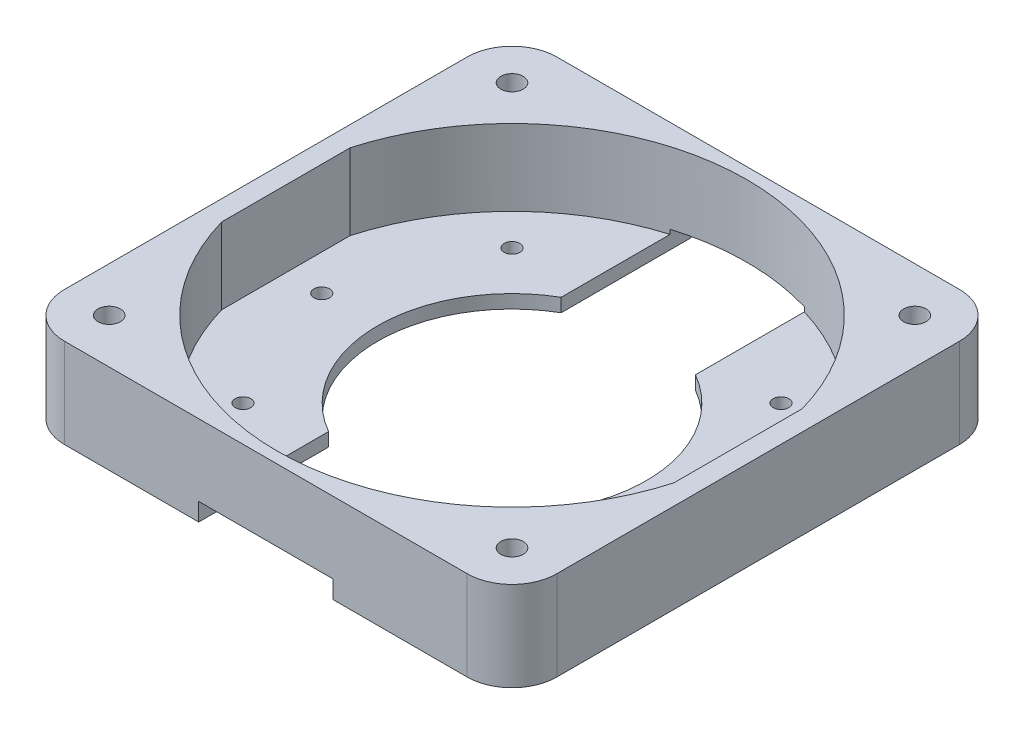
from build123d import *

# Parameters (mm, degrees)
SKETCH_1_W          = 110
SKETCH_1_H          = 110
EXTRUDE_5_DEPTH     = 20
CUT_EXTRUDE_2_DEPTH = 17
SKETCH_5_R          = 1.75
SKETCH_5_R_2        = 30
CUT_EXTRUDE_3_DEPTH = 17
SKETCH_7_W          = 30
SKETCH_7_H          = 114.29986349
CUT_EXTRUDE_4_DEPTH = 4
SKETCH_8_R          = 2.5
CUT_EXTRUDE_5_DEPTH = 81.311892021
FILLET_1_R          = 10
FILLET_2_R          = 10
FILLET_3_R          = 10
FILLET_4_R          = 10
CUT_EXTRUDE_6_DEPTH = 17
CUT_EXTRUDE_7_DEPTH = 17


with BuildPart() as part:
    # 草图1 → 凸台-拉伸5 (new body)
    with BuildSketch(Plane(origin=(0, 0, 0), x_dir=(1, 0, 0), z_dir=(0, 1, 0))):
        Rectangle(SKETCH_1_W, SKETCH_1_H)
    extrude(amount=EXTRUDE_5_DEPTH)

    # 草图4 → 切除-拉伸2 (cut)
    with BuildSketch(Plane(origin=(0, 20, 0), x_dir=(1, 0, 0), z_dir=(0, 1, 0))):
        with BuildLine():
            ThreePointArc((-47, -13.856406461), (0, -49), (47, -13.856406461))
            Line((47, -13.856406461), (47, 13.856406461))
            ThreePointArc((47, 13.856406461), (0, 49), (-47, 13.856406461))
            Line((-47, 13.856406461), (-47, -13.856406461))
        make_face()
    extrude(amount=-CUT_EXTRUDE_2_DEPTH, mode=Mode.SUBTRACT)

    # 草图5 → 切除-拉伸3 (cut)
    with BuildSketch(Plane(origin=(0, 3, 0), x_dir=(1, 0, 0), z_dir=(0, 1, 0))):
        with Locations(Location((0, 42.5, 0), (0, 0, 270))):
            Circle(SKETCH_5_R)
        with Locations(Location((30.0520382, 30.0520382, 0), (0, 0, 270))):
            Circle(SKETCH_5_R)
        with Locations(Location((42.5, 0, 0), (0, 0, 270))):
            Circle(SKETCH_5_R)
        with Locations(Location((30.0520382, -30.0520382, 0), (0, 0, 270))):
            Circle(SKETCH_5_R)
        with Locations(Location((0, -42.5, 0), (0, 0, 270))):
            Circle(SKETCH_5_R)
        with Locations(Location((-30.0520382, -30.0520382, 0), (0, 0, 270))):
            Circle(SKETCH_5_R)
        with Locations(Location((-42.5, 0, 0), (0, 0, 270))):
            Circle(SKETCH_5_R)
        with Locations(Location((-30.0520382, 30.0520382, 0), (0, 0, 270))):
            Circle(SKETCH_5_R)
        with Locations(Location((0, 0, 0), (0, 0, 270))):
            Circle(SKETCH_5_R_2)
    extrude(amount=-CUT_EXTRUDE_3_DEPTH, mode=Mode.SUBTRACT)

    # 草图7 → 切除-拉伸4 (cut)
    with BuildSketch(Plane.XZ):
        Rectangle(SKETCH_7_W, SKETCH_7_H)
    extrude(amount=-CUT_EXTRUDE_4_DEPTH, mode=Mode.SUBTRACT)

    # 草图8 → 切除-拉伸5 (cut, through all)
    with BuildSketch(Plane(origin=(0, 20, 0), x_dir=(1, 0, 0), z_dir=(0, 1, 0))):
        with Locations(Location((45, 45, 0), (0, 0, 270))):
            Circle(SKETCH_8_R)
        with Locations(Location((45, -45, 0), (0, 0, 270))):
            Circle(SKETCH_8_R)
        with Locations(Location((-45, -45, 0), (0, 0, 270))):
            Circle(SKETCH_8_R)
        with Locations(Location((-45, 45, 0), (0, 0, 270))):
            Circle(SKETCH_8_R)
    extrude(amount=-CUT_EXTRUDE_5_DEPTH, mode=Mode.SUBTRACT)

    # 圆角1
    fillet_1_edges = [part.edges().sort_by_distance(p)[0] for p in [
        (55, 10, -55),
    ]]
    fillet(fillet_1_edges, radius=FILLET_1_R)

    # 圆角2
    fillet_2_edges = [part.edges().sort_by_distance(p)[0] for p in [
        (-55, 10, -55),
    ]]
    fillet(fillet_2_edges, radius=FILLET_2_R)

    # 圆角3
    fillet_3_edges = [part.edges().sort_by_distance(p)[0] for p in [
        (-55, 10, 55),
    ]]
    fillet(fillet_3_edges, radius=FILLET_3_R)

    # 圆角4
    fillet_4_edges = [part.edges().sort_by_distance(p)[0] for p in [
        (55, 10, 55),
    ]]
    fillet(fillet_4_edges, radius=FILLET_4_R)

    # 草图10 → 切除-拉伸6 (cut)
    with BuildSketch(Plane(origin=(0, 20, 0), x_dir=(1, 0, 0), z_dir=(0, 1, 0))):
        with BuildLine():
            Line((50, -14.282856857), (50, 14.282856857))
            ThreePointArc((50, 14.282856857), (0, 52), (-50, 14.282856857))
            Line((-50, 14.282856857), (-50, -14.282856857))
            ThreePointArc((-50, -14.282856857), (0, -52), (50, -14.282856857))
        make_face()
    extrude(amount=-CUT_EXTRUDE_6_DEPTH, mode=Mode.SUBTRACT)

    # 草图11 → 切除-拉伸7 (cut)
    with BuildSketch(Plane(origin=(0, 20, 0), x_dir=(1, 0, 0), z_dir=(0, 1, 0))):
        with BuildLine():
            Line((50.5, -14.352700094), (50.5, 14.352700094))
            ThreePointArc((50.5, 14.352700094), (0, 52.5), (-50.5, 14.352700094))
            Line((-50.5, 14.352700094), (-50.5, -14.352700094))
            ThreePointArc((-50.5, -14.352700094), (0, -52.5), (50.5, -14.352700094))
        make_face()
    extrude(amount=-CUT_EXTRUDE_7_DEPTH, mode=Mode.SUBTRACT)


solid = part.part
